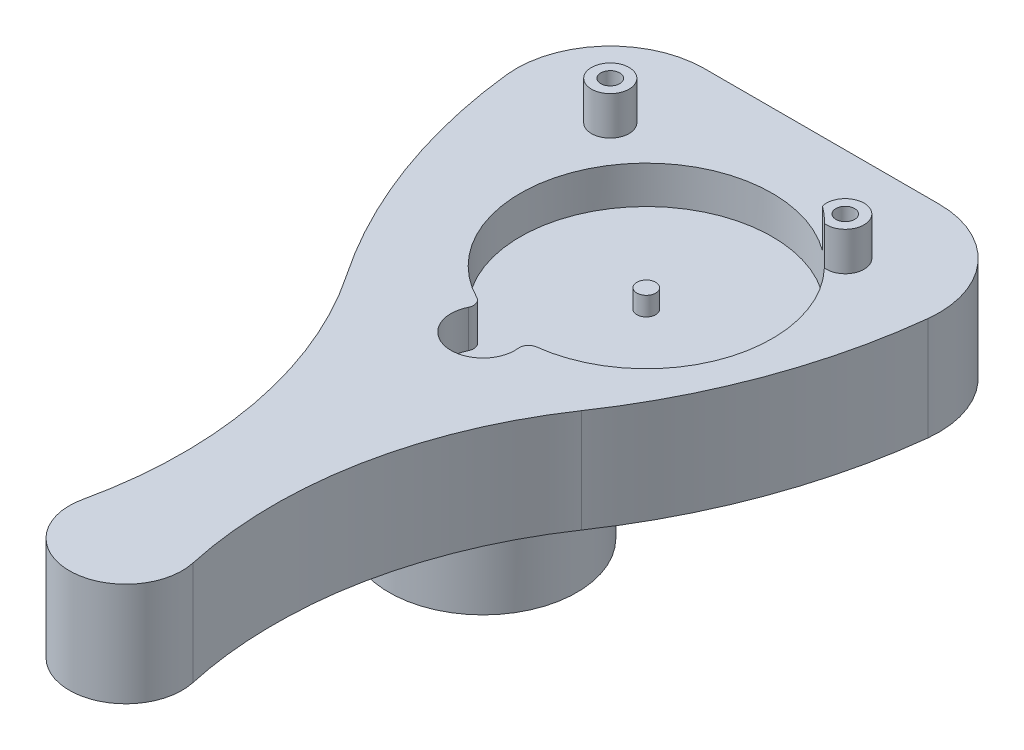
from build123d import *

# Parameters (mm, degrees)
SKETCH3_W           = 26
SKETCH3_H           = 30
BOSS_EXTRUDE1_DEPTH = 3
SKETCH4_R           = 4
SKETCH4_R_2         = 0.5
CUT_EXTRUDE1_DEPTH  = 21.0748599
SKETCH5_W           = 18.5
SKETCH5_H           = 19.522623735
BOSS_EXTRUDE2_DEPTH = 2.5
SKETCH10_W          = 18.5
SKETCH10_H          = 19.522623735
BOSS_EXTRUDE3_DEPTH = 0.5
SKETCH14_R          = 0.5
CUT_EXTRUDE2_DEPTH  = 0.5
BOSS_EXTRUDE4_START = 2
SKETCH15_W          = 18.5
SKETCH15_H          = 19.522623735
SKETCH15_R          = 0.5
BOSS_EXTRUDE4_DEPTH = 2
BOSS_EXTRUDE5_START = 2.05
SKETCH16_R          = 1
SKETCH16_R_2        = 0.5
BOSS_EXTRUDE5_DEPTH = 2.05
BOSS_EXTRUDE6_START = -4.5
SKETCH17_R          = 0.5
BOSS_EXTRUDE6_DEPTH = 4.5
FILLET12_R          = 0.5
SKETCH19_R          = 4
BOSS_EXTRUDE7_DEPTH = 4
SKETCH21_W          = 10
SKETCH21_H          = 1
CUT_EXTRUDE5_DEPTH  = 11
SKETCH22_R          = 1
CUT_EXTRUDE6_DEPTH  = 24.838047483
SKETCH24_W          = 4.80106904
SKETCH24_H          = 1
CUT_EXTRUDE7_DEPTH  = 3
SKETCH25_W          = 26
SKETCH25_H          = 15
BOSS_EXTRUDE8_DEPTH = 5.5
SKETCH26_W          = 26
SKETCH26_H          = 45
CUT_EXTRUDE9_DEPTH  = 5.5
BOSS_EXTRUDE9_DEPTH = 0.01


with BuildPart() as part:
    # Sketch3 → Boss-Extrude1 (new body)
    with BuildSketch(Plane(origin=(0, 0, 0), x_dir=(1, 0, 0), z_dir=(0, 1, 0))):
        Rectangle(SKETCH3_W, SKETCH3_H)
    extrude(amount=BOSS_EXTRUDE1_DEPTH)

    # Sketch4 → Cut-Extrude1 (cut, through all)
    with BuildSketch(Plane(origin=(0, 3, 0), x_dir=(1, 0, 0), z_dir=(0, 1, 0))):
        with Locations(Location((0, -5, 0), (0, 0, 270))):
            Circle(SKETCH4_R)
        with Locations(Location((1.302361333, 2.386058148, 0), (0, 0, 270))):
            Circle(SKETCH4_R_2)
        with Locations(Location((6.25, 8.022623735, 0), (0, 0, 270))):
            Circle(SKETCH4_R_2)
        with Locations(Location((-6.25, 8.022623735, 0), (0, 0, 270))):
            Circle(SKETCH4_R_2)
    extrude(amount=-CUT_EXTRUDE1_DEPTH, mode=Mode.SUBTRACT)

    # Sketch5 → Boss-Extrude2 (add)
    with BuildSketch(Plane(origin=(0, 3, 0), x_dir=(1, 0, 0), z_dir=(0, 1, 0))):
        Polygon((0, -15), (-13, -15), (-13, 15), (13, 15), (13, -15), align=None)
        with Locations((0, 0.261311867)):
            Rectangle(SKETCH5_W, SKETCH5_H, mode=Mode.SUBTRACT)
    extrude(amount=BOSS_EXTRUDE2_DEPTH)

    # Sketch10 → Boss-Extrude3 (add)
    with BuildSketch(Plane(origin=(0, 3, 0), x_dir=(1, 0, 0), z_dir=(0, 1, 0))):
        with Locations((0, 0.261311867)):
            Rectangle(SKETCH10_W, SKETCH10_H)
    extrude(amount=BOSS_EXTRUDE3_DEPTH)

    # Sketch14 → Cut-Extrude2 (cut)
    with BuildSketch(Plane(origin=(0, 3.5, 0), x_dir=(1, 0, 0), z_dir=(0, 1, 0))):
        with Locations(Location((0, -5, 0), (0, 0, 270))):
            Circle(SKETCH14_R)
        with Locations(Location((1.302361333, 2.386058148, 0), (0, 0, 270))):
            Circle(SKETCH14_R)
        with Locations(Location((6.25, 8.022623735, 0), (0, 0, 270))):
            Circle(SKETCH14_R)
        with Locations(Location((-6.25, 8.022623735, 0), (0, 0, 270))):
            Circle(SKETCH14_R)
    extrude(amount=-CUT_EXTRUDE2_DEPTH, mode=Mode.SUBTRACT)

    # Sketch15 → Boss-Extrude4 (add)
    with BuildSketch(Plane(origin=(0, 3.5, 0), x_dir=(1, 0, 0), z_dir=(0, 1, 0)).offset(BOSS_EXTRUDE4_START)):
        with Locations((0, 0.261311867)):
            Rectangle(SKETCH15_W, SKETCH15_H)
        with Locations(Location((6.25, 8.022623735, 0), (0, 0, 270))):
            Circle(SKETCH15_R, mode=Mode.SUBTRACT)
        with Locations(Location((-6.25, 8.022623735, 0), (0, 0, 270))):
            Circle(SKETCH15_R, mode=Mode.SUBTRACT)
        with BuildLine():
            ThreePointArc((-1.223403614, -3.819625653), (-0.295201902, -6.67417318), (1.553335151, -4.309239616))
            ThreePointArc((1.553335151, -4.309239616), (2.465804123, 8.984270093), (-1.223403614, -3.819625653))
        make_face(mode=Mode.SUBTRACT)
    extrude(amount=-BOSS_EXTRUDE4_DEPTH)

    # Sketch16 → Boss-Extrude5 (add)
    # profile 1 of 2: a face of its own
    with BuildSketch(Plane(origin=(0, 5.5, 0), x_dir=(1, 0, 0), z_dir=(0, 1, 0)).offset(BOSS_EXTRUDE5_START)):
        with Locations(Location((-6.25, 8.022623735, 0), (0, 0, 270))):
            Circle(SKETCH16_R)
        with Locations(Location((-6.25, 8.022623735, 0), (0, 0, 270))):
            Circle(SKETCH16_R_2, mode=Mode.SUBTRACT)
    # profile 2 of 2: a face of its own
    with BuildSketch(Plane(origin=(0, 5.5, 0), x_dir=(1, 0, 0), z_dir=(0, 1, 0)).offset(BOSS_EXTRUDE5_START)):
        with BuildLine():
            ThreePointArc((6.132235507, 7.029582182), (6.909685156, 8.774165813), (5.280603357, 7.777123942))
            ThreePointArc((5.280603357, 7.777123942), (5.722251875, 7.421390072), (6.132235507, 7.029582182))
        make_face()
        with Locations(Location((6.25, 8.022623735, 0), (0, 0, 270))):
            Circle(SKETCH16_R_2, mode=Mode.SUBTRACT)
    extrude(amount=-BOSS_EXTRUDE5_DEPTH)

    # Sketch17 → Boss-Extrude6 (add)
    with BuildSketch(Plane.XZ.offset(BOSS_EXTRUDE6_START)):
        with Locations(Location((1.302361333, -2.386058148, 0), (0, 0, 270))):
            Circle(SKETCH17_R)
    extrude(amount=BOSS_EXTRUDE6_DEPTH)

    # Fillet12
    fillet12_edges = [part.edges().sort_by_distance(p)[0] for p in [
        (1.553335151, 4.5, 4.309239616),
        (-1.223403614, 4.5, 3.819625653),
    ]]
    fillet(fillet12_edges, radius=FILLET12_R)

    # Sketch19 → Boss-Extrude7 (add)
    with BuildSketch(Plane.XZ):
        with BuildLine():
            Line((-4.769696007, 6.5), (-8.769696007, 6.5))
            Line((-8.769696007, 6.5), (-8.769696007, 3.5))
            Line((-8.769696007, 3.5), (-4.769696007, 3.5))
            ThreePointArc((-4.769696007, 3.5), (5, 5), (-4.769696007, 6.5))
        make_face()
        with Locations(Location((0, 5, 0), (0, 0, 90))):
            Circle(SKETCH19_R, mode=Mode.SUBTRACT)
    extrude(amount=BOSS_EXTRUDE7_DEPTH)

    # Sketch21 → Cut-Extrude5 (cut)
    with BuildSketch(Plane.ZY.offset(8.769696007)):
        with Locations((5, -0.5)):
            Rectangle(SKETCH21_W, SKETCH21_H)
    extrude(amount=-CUT_EXTRUDE5_DEPTH, mode=Mode.SUBTRACT)

    # Sketch22 → Cut-Extrude6 (cut, through all)
    with BuildSketch(Plane(origin=(0, 0, 3.5), x_dir=(-1, 0, 0), z_dir=(0, 0, -1))):
        with Locations((6.769696007, -2.5)):
            Circle(SKETCH22_R)
    extrude(amount=-CUT_EXTRUDE6_DEPTH, mode=Mode.SUBTRACT)

    # Sketch24 → Cut-Extrude7 (cut)
    with BuildSketch(Plane.XZ.offset(4)):
        with Locations((-6.369161487, 5)):
            Rectangle(SKETCH24_W, SKETCH24_H)
    extrude(amount=-CUT_EXTRUDE7_DEPTH, mode=Mode.SUBTRACT)

    # Sketch25 → Boss-Extrude8 (add)
    with BuildSketch(Plane(origin=(0, 5.5, 0), x_dir=(1, 0, 0), z_dir=(0, 1, 0))):
        with Locations((0, -22.5)):
            Rectangle(SKETCH25_W, SKETCH25_H)
    extrude(amount=-BOSS_EXTRUDE8_DEPTH)

    # Sketch26 → Cut-Extrude9 (cut)
    with BuildSketch(Plane(origin=(0, 5.5, 0), x_dir=(1, 0, 0), z_dir=(0, 1, 0))):
        with Locations((0, -7.5)):
            Rectangle(SKETCH26_W, SKETCH26_H)
        with BuildLine():
            ThreePointArc((-11.218556104, 7.462757462), (-9.978225541, 11.354340157), (-6.25, 13.022623735))
            Line((-6.25, 13.022623735), (6.25, 13.022623735))
            ThreePointArc((6.25, 13.022623735), (9.978225541, 11.354340157), (11.218556104, 7.462757462))
            ThreePointArc((11.218556104, 7.462757462), (9.549132571, 0.427880225), (6.245206434, -6.003336204))
            ThreePointArc((6.245206434, -6.003336204), (2.799432829, -14.336061152), (2.929225002, -23.352203052))
            ThreePointArc((2.929225002, -23.352203052), (0, -27), (-2.929225002, -23.352203052))
            ThreePointArc((-2.929225002, -23.352203052), (-2.799432829, -14.336061152), (-6.245206434, -6.003336204))
            ThreePointArc((-6.245206434, -6.003336204), (-9.549132571, 0.427880225), (-11.218556104, 7.462757462))
        make_face(mode=Mode.SUBTRACT)
    extrude(amount=-CUT_EXTRUDE9_DEPTH, mode=Mode.SUBTRACT)

    # Sketch29 → Boss-Extrude9 (add)
    with BuildSketch(Plane.XZ):
        with BuildLine():
            ThreePointArc((-2.480835291, 16.657796226), (0, 16.25), (2.480835291, 16.657796226))
            ThreePointArc((2.480835291, 16.657796226), (2.452227673, 20.021932286), (2.929225002, 23.352203052))
            ThreePointArc((2.929225002, 23.352203052), (0, 27), (-2.929225002, 23.352203052))
            ThreePointArc((-2.929225002, 23.352203052), (-2.452227673, 20.021932286), (-2.480835291, 16.657796226))
        make_face()
    extrude(amount=BOSS_EXTRUDE9_DEPTH)


solid = part.part
